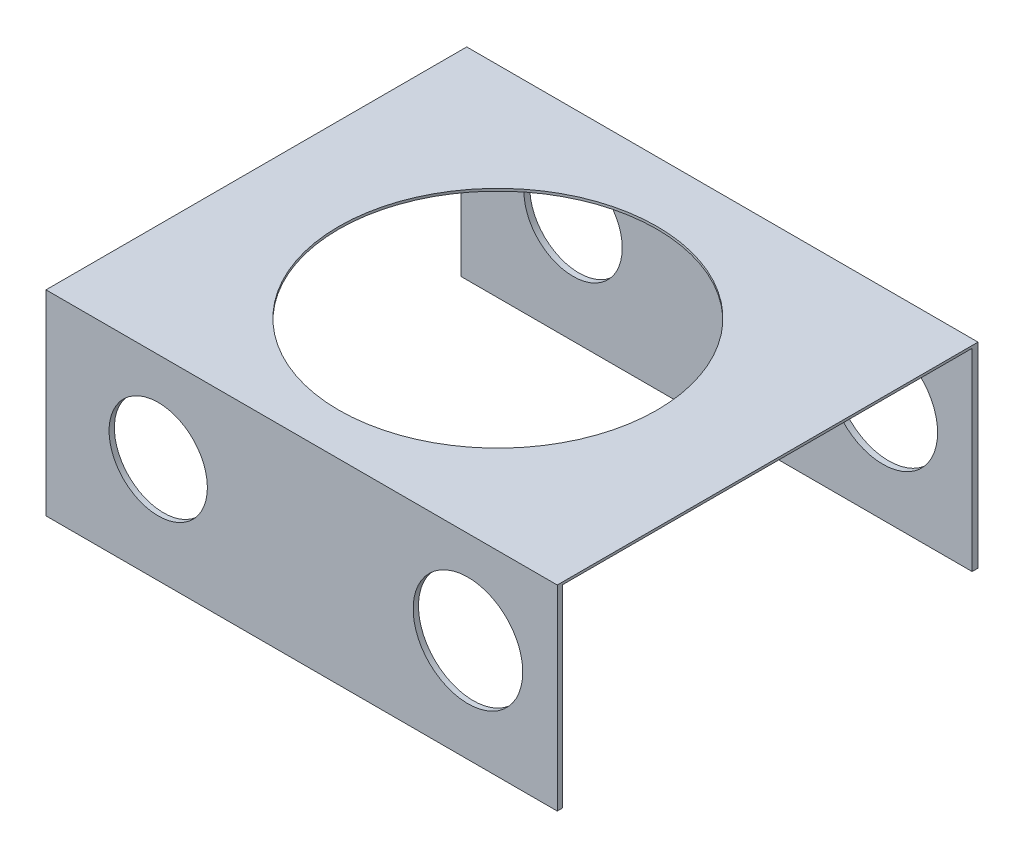
from build123d import *

# Parameters (mm, degrees)
BOSS_EXTRUDE1_DEPTH      = 20.2
BOSS_EXTRUDE1_DEPTH_BACK = 15
SKETCH1_W                = 93.989323661
SKETCH1_H                = 75.639027137
SKETCH1_R                = 28.60558576
CUT_EXTRUDE1_DEPTH       = 65.815428125
CUT_EXTRUDE1_DEPTH_BACK  = 65.815428125
SKETCH7_W                = 73.626868744
SKETCH7_H                = 46
CUT_EXTRUDE2_DEPTH       = 71.936871393
CUT_EXTRUDE2_DEPTH_BACK  = 71.936871393
SKETCH8_W                = 2.074297069
SKETCH8_H                = 75.639027137
CUT_EXTRUDE3_DEPTH       = 92.182778922
CUT_EXTRUDE3_DEPTH_BACK  = 92.182778922
SKETCH9_R                = 9.85217033
SKETCH9_R_2              = 8.836553466


with BuildPart() as part:
    # Sketch1 → Boss-Extrude1 (new, two sides: drawn at the far end of the back side and taken through both)
    # profile 1 of 2: a face of its own
    with BuildSketch(Plane(origin=(0, 0, 0), x_dir=(1, 0, 0), z_dir=(0, 1, 0)).offset(-BOSS_EXTRUDE1_DEPTH_BACK)):
        with Locations((-0.250713069, 1.688387839)):
            Rectangle(SKETCH1_W, SKETCH1_H)
        Polygon((-15.47568065, 38.452030524), (-15.44512512, 38.452030524), (17.164906021, 38.452030524), (43.185007565, 38.452030524), (45.754987202, 38.452030524), (45.754987202, 32.455155104), (45.754987202, 32.45391936), (45.754987202, -35.17483185), (17.616871532, -35.17483185), (-15.375759604, -35.17483185), (-46.245033324, -35.17483185), (-46.245033324, 38.452030524), (-43.675074212, 38.452030524), align=None, mode=Mode.SUBTRACT)
    # profile 2 of 2: a face of its own
    with BuildSketch(Plane(origin=(0, 0, 0), x_dir=(1, 0, 0), z_dir=(0, 1, 0)).offset(-BOSS_EXTRUDE1_DEPTH_BACK)):
        Polygon((17.164906021, 38.452030524), (-15.44512512, 38.452030524), (-15.47568065, 38.452030524), (-43.675074212, 38.452030524), (-46.245033324, 38.452030524), (-46.245033324, -35.17483185), (-15.375759604, -35.17483185), (17.616871532, -35.17483185), (45.754987202, -35.17483185), (45.754987202, 32.45391936), (45.754987202, 32.455155104), (45.754987202, 38.452030524), (43.185007565, 38.452030524), align=None)
        with Locations(Location((-0.126795962, 0.062260433, 0), (0, 0, 270))):
            Circle(SKETCH1_R, mode=Mode.SUBTRACT)
    extrude(amount=BOSS_EXTRUDE1_DEPTH + BOSS_EXTRUDE1_DEPTH_BACK)

    # Sketch7 → Cut-Extrude1 (cut, two sides: drawn at the far end of the back side and taken through both)
    with BuildSketch(Plane(origin=(0, 0, 0), x_dir=(0, 0, -1), z_dir=(1, 0, 0)).offset(-CUT_EXTRUDE1_DEPTH_BACK)):
        with Locations((1.63860241, -3.238314763)):
            Rectangle(SKETCH7_W, SKETCH7_H)
    extrude(amount=CUT_EXTRUDE1_DEPTH + CUT_EXTRUDE1_DEPTH_BACK, mode=Mode.SUBTRACT)

    # Sketch8 → Cut-Extrude2 (cut, two sides: drawn at the far end of the back side and taken through both)
    with BuildSketch(Plane(origin=(0, 20.2, 0), x_dir=(1, 0, 0), z_dir=(0, 1, 0)).offset(-CUT_EXTRUDE2_DEPTH_BACK)):
        with Locations((-46.208226366, 1.688387839)):
            Rectangle(SKETCH8_W, SKETCH8_H)
    extrude(amount=CUT_EXTRUDE2_DEPTH + CUT_EXTRUDE2_DEPTH_BACK, mode=Mode.SUBTRACT)

    # Sketch9 → Cut-Extrude3 (cut, two sides: drawn at the far end of the back side and taken through both)
    with BuildSketch(Plane.XY.offset(36.131125729).offset(-CUT_EXTRUDE3_DEPTH_BACK)):
        with Locations((30.686426908, 3.531311209)):
            Circle(SKETCH9_R)
        with Locations((-24.996180107, 3.923442244)):
            Circle(SKETCH9_R_2)
    extrude(amount=CUT_EXTRUDE3_DEPTH + CUT_EXTRUDE3_DEPTH_BACK, mode=Mode.SUBTRACT)


solid = part.part
